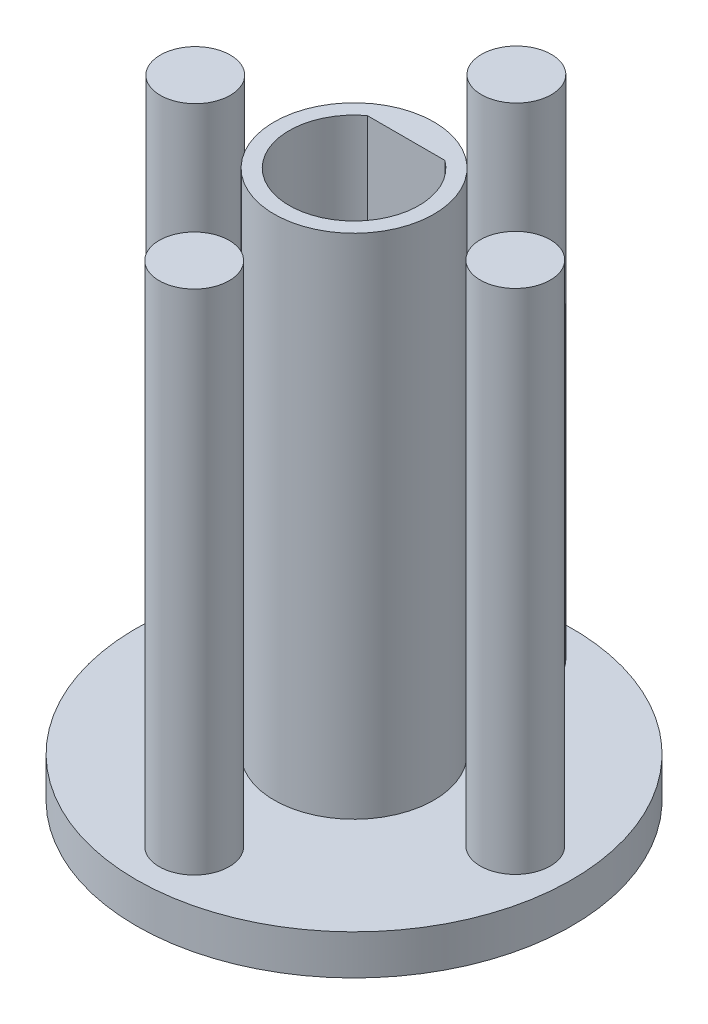
from build123d import *

# Parameters (mm, degrees)
SKETCH3_R             = 1.75
BOSS_EXTRUDE1_DEPTH   = 27.4
BOSS_EXTRUDE1_2_DEPTH = 27.4
BOSS_EXTRUDE1_3_DEPTH = 27.4
BOSS_EXTRUDE1_4_DEPTH = 27.4
SKETCH3_R_2           = 4
BOSS_EXTRUDE1_5_DEPTH = 27.4
SKETCH3_17_R          = 10.9
BOSS_EXTRUDE2_DEPTH   = 2


with BuildPart() as part:
    # Sketch3 → Boss-Extrude1 (new body)
    with BuildSketch(Plane(origin=(0, 0, 0), x_dir=(1, 0, 0), z_dir=(0, 1, 0))):
        with Locations((0.009034474, 8.115584077)):
            Circle(SKETCH3_R)
    extrude(amount=BOSS_EXTRUDE1_DEPTH)



with BuildPart() as body_2:
    # Sketch3 → Boss-Extrude1 2 (new body)
    with BuildSketch(Plane(origin=(0, 0, 0), x_dir=(1, 0, 0), z_dir=(0, 1, 0))):
        with Locations((8.017679827, 0.053335715)):
            Circle(SKETCH3_R)
    extrude(amount=BOSS_EXTRUDE1_2_DEPTH)


with BuildPart() as body_3:
    # Sketch3 → Boss-Extrude1 3 (new body)
    with BuildSketch(Plane(origin=(0, 0, 0), x_dir=(1, 0, 0), z_dir=(0, 1, 0))):
        with Locations((0.009179949, -8.009057152)):
            Circle(SKETCH3_R)
    extrude(amount=BOSS_EXTRUDE1_3_DEPTH)


with BuildPart() as body_4:
    # Sketch3 → Boss-Extrude1 4 (new body)
    with BuildSketch(Plane(origin=(0, 0, 0), x_dir=(1, 0, 0), z_dir=(0, 1, 0))):
        with Locations((-7.999465404, 0.05319121)):
            Circle(SKETCH3_R)
    extrude(amount=BOSS_EXTRUDE1_4_DEPTH)


with BuildPart() as body_5:
    # Sketch3 → Boss-Extrude1 5 (new body)
    with BuildSketch(Plane(origin=(0, 0, 0), x_dir=(1, 0, 0), z_dir=(0, 1, 0))):
        Circle(SKETCH3_R_2)
        with BuildLine():
            Line((-1.942645776, 2.605499451), (1.942645776, 2.605499451))
            ThreePointArc((1.942645776, 2.605499451), (0, -3.25), (-1.942645776, 2.605499451))
        make_face(mode=Mode.SUBTRACT)
    extrude(amount=BOSS_EXTRUDE1_5_DEPTH)


with BuildPart() as part_1:
    add(part.part)

    add(body_2.part)  # Boss-Extrude2 merges body 2

    add(body_3.part)  # Boss-Extrude2 merges body 3

    add(body_4.part)  # Boss-Extrude2 merges body 4

    add(body_5.part)  # Boss-Extrude2 merges body 5
    # Sketch3<17> → Boss-Extrude2 (add)
    with BuildSketch(Plane(origin=(0, 0, 0), x_dir=(1, 0, 0), z_dir=(0, 1, 0))):
        Circle(SKETCH3_17_R)
    extrude(amount=BOSS_EXTRUDE2_DEPTH)


solid = part_1.part
